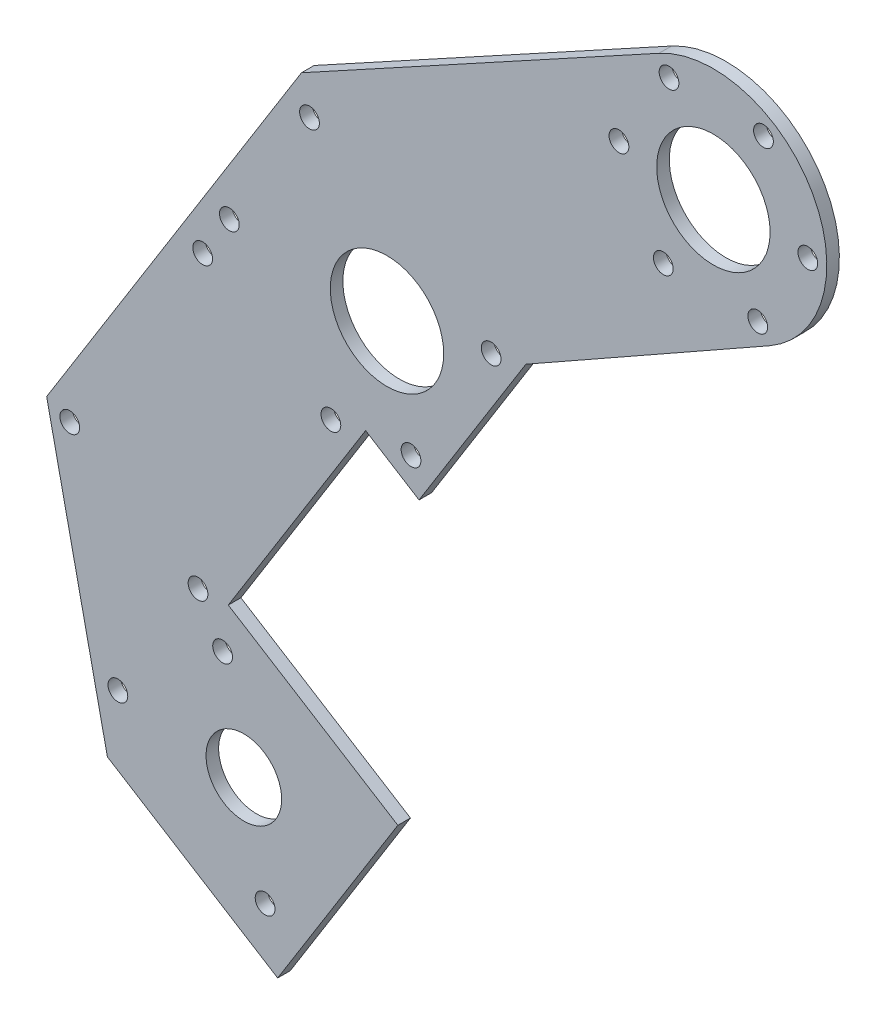
from build123d import *

# Parameters (mm, degrees)
SKETCH1_R              = 14.2875
SKETCH1_R_2            = 9.525
BOSS_EXTRUDE1_DEPTH    = 3.175
F_10_CLEARANCE_HOLE2_D = 4.9784
F_10_CLEARANCE_HOLE3_D = 4.9784


with BuildPart() as part:
    # Sketch1 → Boss-Extrude1 (new body)
    with BuildSketch(Plane.XY.offset(-14.194599474)):
        with BuildLine():
            Line((-11.403602879, 461.040918113), (18.881283072, 509.506866808))
            Line((18.881283072, 509.506866808), (-23.846467356, 536.206128526))
            Line((-23.846467356, 536.206128526), (10.759214603, 591.586796266))
            Line((10.759214603, 591.586796266), (24.22197813, 583.174327946))
            Line((24.22197813, 583.174327946), (51.141876753, 626.255171231))
            Line((51.141876753, 626.255171231), (112.462044501, 660.93728694))
            ThreePointArc((112.462044501, 660.93728694), (123.365099157, 699.702028841), (84.677956887, 710.877306848))
            Line((84.677956887, 710.877306848), (-5.401730059, 661.587538174))
            Line((-5.401730059, 661.587538174), (-69.615486106, 558.824047132))
            Line((-69.615486106, 558.824047132), (-54.307899735, 487.850498283))
            Line((-54.307899735, 487.850498283), (-11.403602879, 461.040918113))
        make_face()
        with Locations((16.14150623, 618.174698631)):
            Circle(SKETCH1_R, mode=Mode.SUBTRACT)
        with Locations((-19.923573493, 500.543719921)):
            Circle(SKETCH1_R_2, mode=Mode.SUBTRACT)
        with Locations((98.394472266, 685.809641802)):
            Circle(SKETCH1_R, mode=Mode.SUBTRACT)
    extrude(amount=BOSS_EXTRUDE1_DEPTH)

    # #10 Clearance Hole2 (through all)
    with Locations(Plane.XY.offset(-11.019599474)):
        with Locations((-25.278710379, 525.37278573), (-14.568436607, 475.714654113), (-3.381611976, 652.837445435), (42.391784014, 624.235053148), (22.201860047, 591.924420685), (-23.571535943, 620.526812972), (-31.474844299, 535.981130963), (-63.785476762, 556.17105493), (-51.664768266, 503.670498499), (2.009121865, 589.566678183), (-30.301510599, 609.756602151)):
            Hole(F_10_CLEARANCE_HOLE2_D / 2)

    # #10 Clearance Hole3 (through all)
    with Locations(Plane.XY.offset(-11.019599474)):
        with Locations((111.013174745, 706.003787092), (122.192466334, 684.978597537), (109.573763855, 664.784452247), (85.775769786, 665.615496512), (74.596478197, 686.640686067), (87.215180677, 706.834831357)):
            Hole(F_10_CLEARANCE_HOLE3_D / 2)


solid = part.part
